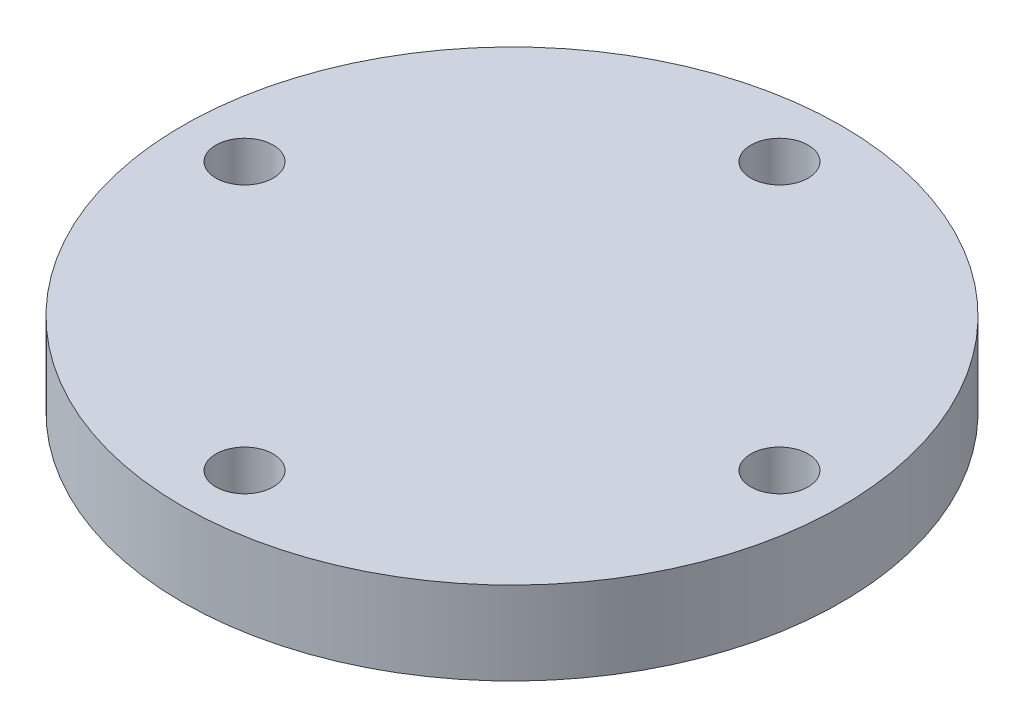
from build123d import *

# Parameters (mm, degrees)
SKETCH_1_R          = 34.5
EXTRUDE_1_DEPTH     = 8.7
SKETCH_2_R          = 3
CUT_EXTRUDE_2_DEPTH = 8.7


with BuildPart() as part:
    # Эскиз1 → Вытянуть1 (new body)
    with BuildSketch(Plane(origin=(0, 0, 0), x_dir=(1, 0, 0), z_dir=(0, 1, 0))):
        with Locations(Location((0, 0, 0), (0, 0, 270))):
            Circle(SKETCH_1_R)
    extrude(amount=EXTRUDE_1_DEPTH)

    # Эскиз2 → Вытянуть2 (cut)
    with BuildSketch(Plane(origin=(0, 8.7, 0), x_dir=(1, 0, 0), z_dir=(0, 1, 0))):
        with Locations(Location((0, 28, 0), (0, 0, 270))):
            Circle(SKETCH_2_R)
        with Locations(Location((28, 0, 0), (0, 0, 270))):
            Circle(SKETCH_2_R)
        with Locations(Location((0, -28, 0), (0, 0, 270))):
            Circle(SKETCH_2_R)
        with Locations(Location((-28, 0, 0), (0, 0, 270))):
            Circle(SKETCH_2_R)
    extrude(amount=-CUT_EXTRUDE_2_DEPTH, mode=Mode.SUBTRACT)


solid = part.part
